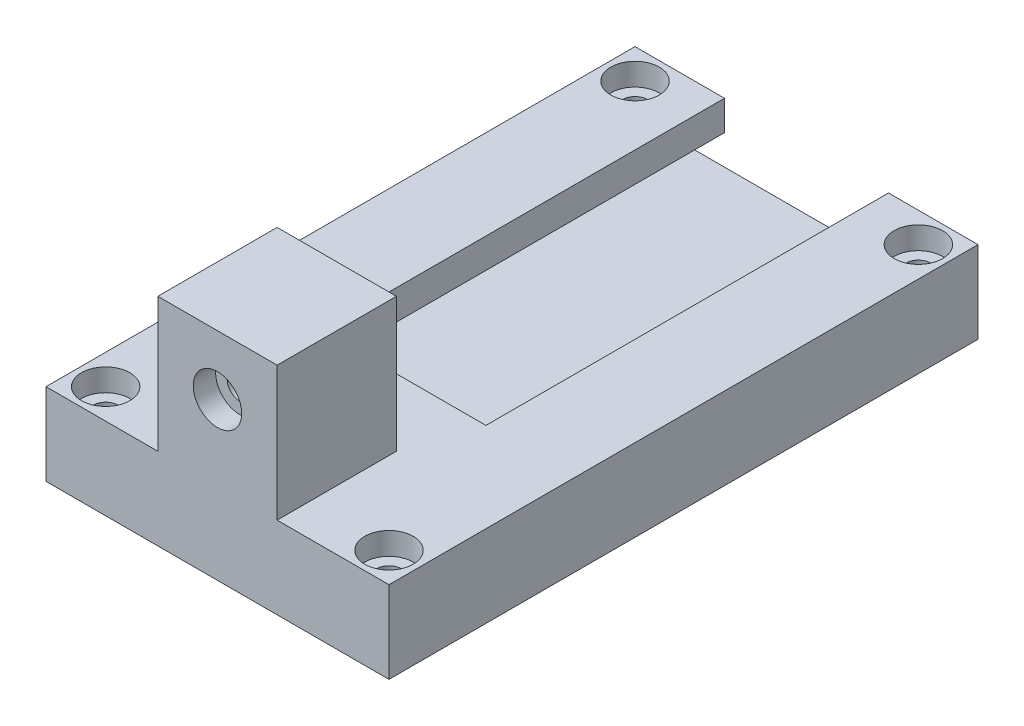
from build123d import *

# Parameters (mm, degrees)
EXTRUDE_1_DEPTH             = 54
EXTRUDE_2_DEPTH             = 25
HOLE_WIZARD_M31_D           = 3.4
HOLE_WIZARD_M31_CBORE_D     = 6.5
HOLE_WIZARD_M31_CBORE_DEPTH = 3
SKETCH_6_W                  = 16
SKETCH_6_H                  = 16
EXTRUDE_3_DEPTH             = 18
HOLE_WIZARD_M32_D           = 3.4
HOLE_WIZARD_M32_CBORE_D     = 6.5
HOLE_WIZARD_M32_CBORE_DEPTH = 3


with BuildPart() as part:
    # Эскиз1 → Бобышка-Вытянуть1 (new body)
    with BuildSketch(Plane.XY):
        Polygon((0, 0), (0, 11), (12, 11), (12, 7), (8, 7), (8, 3), (38, 3), (38, 7), (34, 7), (34, 11), (46, 11), (46, 0), align=None)
    extrude(amount=EXTRUDE_1_DEPTH)

    # Эскиз2 → Бобышка-Вытянуть2 (add)
    with BuildSketch(Plane.XY.offset(54)):
        Polygon((0, 11), (12, 11), (34, 11), (46, 11), (46, 0), (0, 0), align=None)
    extrude(amount=EXTRUDE_2_DEPTH)

    # Цековка для винта с внутренним шестигранником M31 (through all)
    with Locations(Plane(origin=(0, 11, 0), x_dir=(1, 0, 0), z_dir=(0, 1, 0))):
        with Locations((42, -4), (42, -75), (4, -4), (4, -75)):
            CounterBoreHole(HOLE_WIZARD_M31_D / 2, HOLE_WIZARD_M31_CBORE_D / 2, HOLE_WIZARD_M31_CBORE_DEPTH)

    # Эскиз6 → Бобышка-Вытянуть3 (add)
    with BuildSketch(Plane(origin=(0, 11, 0), x_dir=(1, 0, 0), z_dir=(0, 1, 0))):
        with Locations((23, -71)):
            Rectangle(SKETCH_6_W, SKETCH_6_H)
    extrude(amount=EXTRUDE_3_DEPTH)

    # Цековка для винта с внутренним шестигранником M32 (through all)
    with Locations(Plane.XY.offset(79)):
        with Locations((23, 21)):
            CounterBoreHole(HOLE_WIZARD_M32_D / 2, HOLE_WIZARD_M32_CBORE_D / 2, HOLE_WIZARD_M32_CBORE_DEPTH)


solid = part.part
